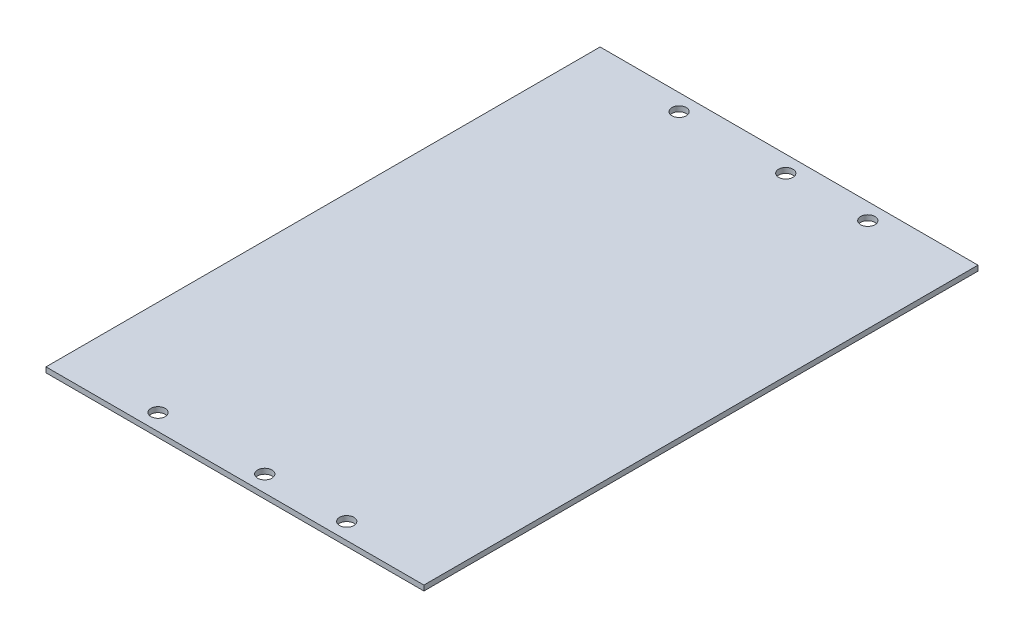
from build123d import *

# Parameters (mm, degrees)
SKETCH1_W           = 145.2
SKETCH1_H           = 212.895
SKETCH1_R           = 2.75
BOSS_EXTRUDE1_DEPTH = 2


with BuildPart() as part:
    # Sketch1 → Boss-Extrude1 (new body)
    with BuildSketch(Plane(origin=(0, 0, 0), x_dir=(1, 0, 0), z_dir=(0, 1, 0))):
        with Locations((78.3, 107.8525)):
            Rectangle(SKETCH1_W, SKETCH1_H)
        with Locations(Location((42.4, 207.95, 0), (0, 0, 270))):
            Circle(SKETCH1_R, mode=Mode.SUBTRACT)
        with Locations(Location((83.4, 207.95, 0), (0, 0, 270))):
            Circle(SKETCH1_R, mode=Mode.SUBTRACT)
        with Locations(Location((114.9, 207.95, 0), (0, 0, 270))):
            Circle(SKETCH1_R, mode=Mode.SUBTRACT)
        with Locations(Location((114.9, 7.755, 0), (0, 0, 90))):
            Circle(SKETCH1_R, mode=Mode.SUBTRACT)
        with Locations(Location((83.4, 7.755, 0), (0, 0, 90))):
            Circle(SKETCH1_R, mode=Mode.SUBTRACT)
        with Locations(Location((42.4, 7.755, 0), (0, 0, 90))):
            Circle(SKETCH1_R, mode=Mode.SUBTRACT)
    extrude(amount=BOSS_EXTRUDE1_DEPTH)


solid = part.part
